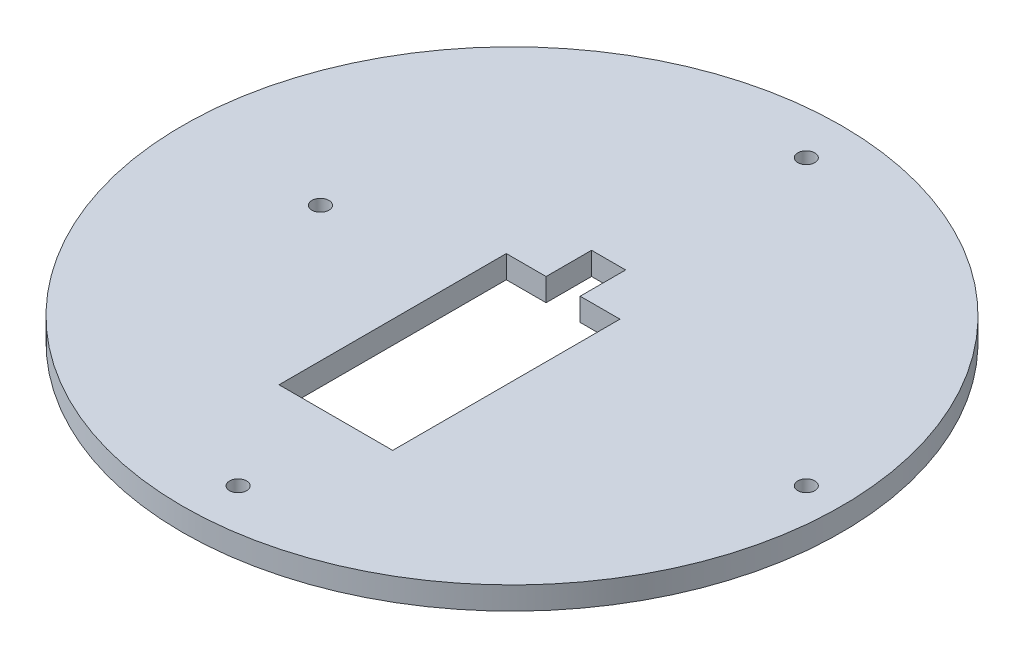
from build123d import *

# Parameters (mm, degrees)
SKETCH_1_R          = 58
EXTRUDE_1_DEPTH     = 4
SKETCH_3_R          = 1.5
CUT_EXTRUDE_1_DEPTH = 50
CUT_EXTRUDE_2_DEPTH = 500


with BuildPart() as part:
    # 草图1 → 凸台-拉伸1 (new body)
    with BuildSketch(Plane(origin=(0, 0, 0), x_dir=(1, 0, 0), z_dir=(0, 1, 0))):
        with Locations(Location((0, 0, 0), (0, 0, 270))):
            Circle(SKETCH_1_R)
    extrude(amount=EXTRUDE_1_DEPTH)

    # 草图3 → 切除-拉伸1 (cut)
    with BuildSketch(Plane.XZ):
        with Locations(Location((1.793366497, -50, 0), (0, 0, 270))):
            Circle(SKETCH_3_R)
        with Locations(Location((-33.706633503, 0, 0), (0, 0, 270))):
            Circle(SKETCH_3_R)
        with Locations(Location((1.793366497, 50, 0), (0, 0, 270))):
            Circle(SKETCH_3_R)
        with Locations(Location((51.793366497, 0, 0), (0, 0, 270))):
            Circle(SKETCH_3_R)
    extrude(amount=-CUT_EXTRUDE_1_DEPTH, mode=Mode.SUBTRACT)

    # 草图4 → 切除-拉伸2 (cut)
    with BuildSketch(Plane(origin=(0, 4, 0), x_dir=(1, 0, 0), z_dir=(0, 1, 0))):
        Polygon((3, 9), (10, 9), (10, -31), (-10, -31), (-10, 9), (-3, 9), (-3, 17), (3, 17), align=None)
    extrude(amount=-CUT_EXTRUDE_2_DEPTH, mode=Mode.SUBTRACT)


solid = part.part
